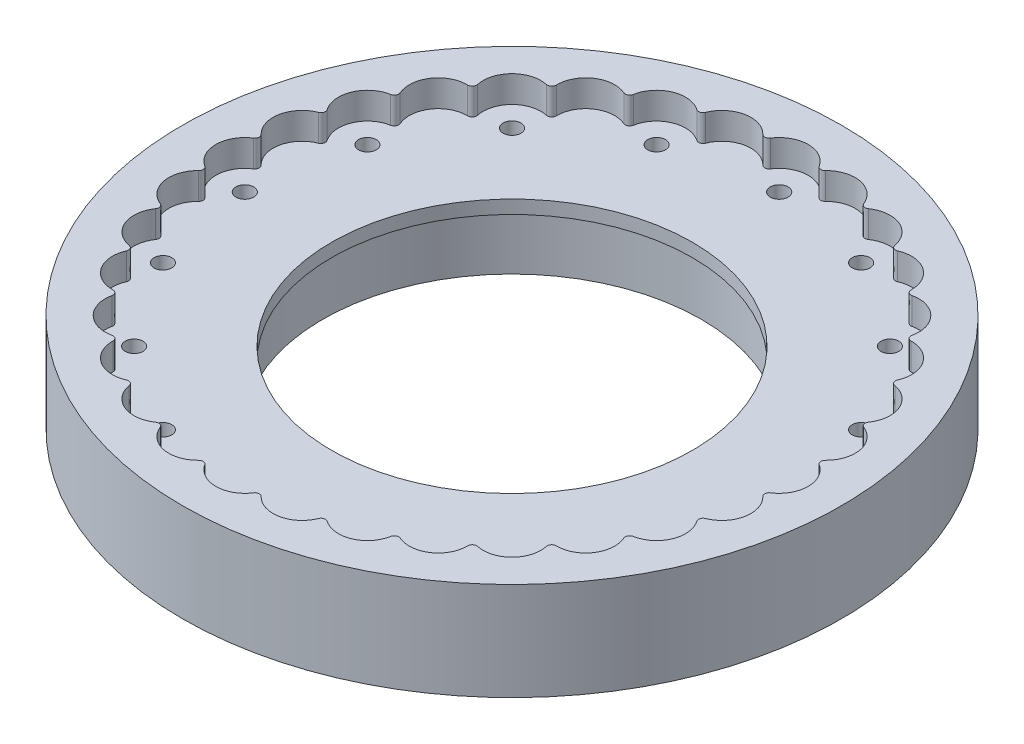
from build123d import *

# Parameters (mm, degrees)
SKETCH_1_R          = 74
EXTRUDE_1_DEPTH     = 6
EXTRUDE_START       = 16
SKETCH_2_R          = 74
EXTRUDE_2_DEPTH     = 16
SKETCH_3_R          = 2
CUT_EXTRUDE_1_DEPTH = 16
CUT_EXTRUDE_START   = -4.5
SKETCH_4_R          = 3.75
SKETCH_4_R_2        = 2
CUT_EXTRUDE_2_DEPTH = 4.5
FILLET_1_R          = 1
FILLET_2_R          = 1
SKETCH_5_R          = 40.5
CUT_EXTRUDE_5_DEPTH = 110.036691231
SKETCH_6_R          = 42.5
CUT_EXTRUDE_6_DEPTH = 13


with BuildPart() as part:
    # 草图1 → 凸台-拉伸1 (new body)
    with BuildSketch(Plane(origin=(0, 0, 0), x_dir=(1, 0, 0), z_dir=(0, 1, 0))):
        with Locations(Location((-3, 0, 0), (0, 0, 270))):
            Circle(SKETCH_1_R)
        with BuildLine():
            ThreePointArc((-68.222221147, 12.973506414), (-67.787057046, 9.065890923), (-65.178531856, 6.124050861))
            ThreePointArc((-65.178531856, 6.124050861), (-68.310859491, 3.74763545), (-69.5, 0))
            ThreePointArc((-69.5, 0), (-68.310859491, -3.74763545), (-65.178531856, -6.124050861))
            ThreePointArc((-65.178531856, -6.124050861), (-67.787057046, -9.065890923), (-68.222221147, -12.973506414))
            ThreePointArc((-68.222221147, -12.973506414), (-66.324802233, -16.417142295), (-62.789045747, -18.136808743))
            ThreePointArc((-62.789045747, -18.136808743), (-64.773524332, -21.531020193), (-64.437988912, -25.448448252))
            ThreePointArc((-64.437988912, -25.448448252), (-61.905208337, -28.455747568), (-58.10190014, -29.452579237))
            ThreePointArc((-58.10190014, -29.452579237), (-59.38606972, -33.168724431), (-58.292729218, -36.945420496))
            ThreePointArc((-58.292729218, -36.945420496), (-55.22192032, -39.400814421), (-51.297219412, -39.636503628))
            ThreePointArc((-51.297219412, -39.636503628), (-51.831730071, -43.531773191), (-50.022600949, -47.022600949))
            ThreePointArc((-50.022600949, -47.022600949), (-46.531773191, -48.831730071), (-42.636503628, -48.297219412))
            ThreePointArc((-42.636503628, -48.297219412), (-42.400814421, -52.22192032), (-39.945420496, -55.292729218))
            ThreePointArc((-39.945420496, -55.292729218), (-36.168724431, -56.38606972), (-32.452579237, -55.10190014))
            ThreePointArc((-32.452579237, -55.10190014), (-31.455747568, -58.905208337), (-28.448448252, -61.437988912))
            ThreePointArc((-28.448448252, -61.437988912), (-24.531020193, -61.773524332), (-21.136808743, -59.789045747))
            ThreePointArc((-21.136808743, -59.789045747), (-19.417142295, -63.324802232), (-15.973506414, -65.222221147))
            ThreePointArc((-15.973506414, -65.222221147), (-12.065890923, -64.787057046), (-9.124050861, -62.178531856))
            ThreePointArc((-9.124050861, -62.178531856), (-6.74763545, -65.310859491), (-3, -66.5))
            ThreePointArc((-3, -66.5), (0.74763545, -65.310859491), (3.124050861, -62.178531856))
            ThreePointArc((3.124050861, -62.178531856), (6.065890923, -64.787057046), (9.973506414, -65.222221147))
            ThreePointArc((9.973506414, -65.222221147), (13.417142295, -63.324802232), (15.136808743, -59.789045747))
            ThreePointArc((15.136808743, -59.789045747), (18.531020193, -61.773524332), (22.448448252, -61.437988912))
            ThreePointArc((22.448448252, -61.437988912), (25.455747568, -58.905208337), (26.452579237, -55.10190014))
            ThreePointArc((26.452579237, -55.10190014), (30.168724431, -56.38606972), (33.945420496, -55.292729218))
            ThreePointArc((33.945420496, -55.292729218), (36.400814421, -52.22192032), (36.636503628, -48.297219412))
            ThreePointArc((36.636503628, -48.297219412), (40.531773191, -48.831730071), (44.022600949, -47.022600949))
            ThreePointArc((44.022600949, -47.022600949), (45.831730071, -43.531773191), (45.297219412, -39.636503628))
            ThreePointArc((45.297219412, -39.636503628), (49.22192032, -39.400814421), (52.292729218, -36.945420496))
            ThreePointArc((52.292729218, -36.945420496), (53.38606972, -33.168724431), (52.10190014, -29.452579237))
            ThreePointArc((52.10190014, -29.452579237), (55.905208337, -28.455747568), (58.437988912, -25.448448252))
            ThreePointArc((58.437988912, -25.448448252), (58.773524332, -21.531020193), (56.789045747, -18.136808743))
            ThreePointArc((56.789045747, -18.136808743), (60.324802232, -16.417142295), (62.222221147, -12.973506414))
            ThreePointArc((62.222221147, -12.973506414), (61.787057046, -9.065890923), (59.178531856, -6.124050861))
            ThreePointArc((59.178531856, -6.124050861), (62.310859491, -3.74763545), (63.5, 0))
            ThreePointArc((63.5, 0), (62.310859491, 3.74763545), (59.178531856, 6.124050861))
            ThreePointArc((59.178531856, 6.124050861), (61.787057046, 9.065890923), (62.222221147, 12.973506414))
            ThreePointArc((62.222221147, 12.973506414), (60.324802232, 16.417142295), (56.789045747, 18.136808743))
            ThreePointArc((56.789045747, 18.136808743), (58.773524332, 21.531020193), (58.437988912, 25.448448252))
            ThreePointArc((58.437988912, 25.448448252), (55.905208337, 28.455747568), (52.10190014, 29.452579237))
            ThreePointArc((52.10190014, 29.452579237), (53.38606972, 33.168724431), (52.292729218, 36.945420496))
            ThreePointArc((52.292729218, 36.945420496), (49.22192032, 39.400814421), (45.297219412, 39.636503628))
            ThreePointArc((45.297219412, 39.636503628), (45.831730071, 43.531773191), (44.022600949, 47.022600949))
            ThreePointArc((44.022600949, 47.022600949), (40.531773191, 48.831730071), (36.636503628, 48.297219412))
            ThreePointArc((36.636503628, 48.297219412), (36.400814421, 52.22192032), (33.945420496, 55.292729218))
            ThreePointArc((33.945420496, 55.292729218), (30.168724431, 56.38606972), (26.452579237, 55.10190014))
            ThreePointArc((26.452579237, 55.10190014), (25.455747568, 58.905208337), (22.448448252, 61.437988912))
            ThreePointArc((22.448448252, 61.437988912), (18.531020193, 61.773524332), (15.136808743, 59.789045747))
            ThreePointArc((15.136808743, 59.789045747), (13.417142295, 63.324802232), (9.973506414, 65.222221147))
            ThreePointArc((9.973506414, 65.222221147), (6.065890923, 64.787057046), (3.124050861, 62.178531856))
            ThreePointArc((3.124050861, 62.178531856), (0.74763545, 65.310859491), (-3, 66.5))
            ThreePointArc((-3, 66.5), (-6.74763545, 65.310859491), (-9.124050861, 62.178531856))
            ThreePointArc((-9.124050861, 62.178531856), (-12.065890923, 64.787057046), (-15.973506414, 65.222221147))
            ThreePointArc((-15.973506414, 65.222221147), (-19.417142295, 63.324802232), (-21.136808743, 59.789045747))
            ThreePointArc((-21.136808743, 59.789045747), (-24.531020193, 61.773524332), (-28.448448252, 61.437988912))
            ThreePointArc((-28.448448252, 61.437988912), (-31.455747568, 58.905208337), (-32.452579237, 55.10190014))
            ThreePointArc((-32.452579237, 55.10190014), (-36.168724431, 56.38606972), (-39.945420496, 55.292729218))
            ThreePointArc((-39.945420496, 55.292729218), (-42.400814421, 52.22192032), (-42.636503628, 48.297219412))
            ThreePointArc((-42.636503628, 48.297219412), (-46.531773191, 48.831730071), (-50.022600949, 47.022600949))
            ThreePointArc((-50.022600949, 47.022600949), (-51.831730071, 43.531773191), (-51.297219412, 39.636503628))
            ThreePointArc((-51.297219412, 39.636503628), (-55.22192032, 39.400814421), (-58.292729218, 36.945420496))
            ThreePointArc((-58.292729218, 36.945420496), (-59.38606972, 33.168724431), (-58.10190014, 29.452579237))
            ThreePointArc((-58.10190014, 29.452579237), (-61.905208337, 28.455747568), (-64.437988912, 25.448448252))
            ThreePointArc((-64.437988912, 25.448448252), (-64.773524332, 21.531020193), (-62.789045747, 18.136808743))
            ThreePointArc((-62.789045747, 18.136808743), (-66.324802233, 16.417142295), (-68.222221147, 12.973506414))
        make_face(mode=Mode.SUBTRACT)
    extrude(amount=EXTRUDE_1_DEPTH)

    # 草图2 → 凸台-拉伸2 (add)
    with BuildSketch(Plane.XZ.offset(EXTRUDE_START)):
        with Locations(Location((-3, 0, 0), (0, 0, 270))):
            Circle(SKETCH_2_R)
    extrude(amount=-EXTRUDE_2_DEPTH)

    # 草图3 → 切除-拉伸1 (cut)
    with BuildSketch(Plane(origin=(0, 0, 0), x_dir=(1, 0, 0), z_dir=(0, 1, 0))):
        with Locations(Location((-63, 0, 0), (0, 0, 270))):
            Circle(SKETCH_3_R)
        with Locations(Location((-58.432771951, 22.961005942, 0), (0, 0, 270))):
            Circle(SKETCH_3_R)
        with Locations(Location((-45.426406871, 42.426406871, 0), (0, 0, 270))):
            Circle(SKETCH_3_R)
        with Locations(Location((-25.961005942, 55.432771951, 0), (0, 0, 270))):
            Circle(SKETCH_3_R)
        with Locations(Location((-3, 60, 0), (0, 0, 270))):
            Circle(SKETCH_3_R)
        with Locations(Location((19.961005942, 55.432771951, 0), (0, 0, 270))):
            Circle(SKETCH_3_R)
        with Locations(Location((39.426406871, 42.426406871, 0), (0, 0, 270))):
            Circle(SKETCH_3_R)
        with Locations(Location((52.432771951, 22.961005942, 0), (0, 0, 270))):
            Circle(SKETCH_3_R)
        with Locations(Location((57, 0, 0), (0, 0, 270))):
            Circle(SKETCH_3_R)
        with Locations(Location((52.432771951, -22.961005942, 0), (0, 0, 270))):
            Circle(SKETCH_3_R)
        with Locations(Location((39.426406871, -42.426406871, 0), (0, 0, 270))):
            Circle(SKETCH_3_R)
        with Locations(Location((19.961005942, -55.432771951, 0), (0, 0, 270))):
            Circle(SKETCH_3_R)
        with Locations(Location((-3, -60, 0), (0, 0, 270))):
            Circle(SKETCH_3_R)
        with Locations(Location((-25.961005942, -55.432771951, 0), (0, 0, 270))):
            Circle(SKETCH_3_R)
        with Locations(Location((-45.426406871, -42.426406871, 0), (0, 0, 270))):
            Circle(SKETCH_3_R)
        with Locations(Location((-58.432771951, -22.961005942, 0), (0, 0, 270))):
            Circle(SKETCH_3_R)
    extrude(amount=-CUT_EXTRUDE_1_DEPTH, mode=Mode.SUBTRACT)

    # 草图4 → 切除-拉伸2 (cut)
    # profile 1 of 16: a face of its own
    with BuildSketch(Plane.XZ.offset(16).offset(CUT_EXTRUDE_START)):
        with Locations(Location((-63, 0, 0), (0, 0, 270))):
            Circle(SKETCH_4_R)
        with Locations(Location((-63, 0, 0), (0, 0, 90))):
            Circle(SKETCH_4_R_2, mode=Mode.SUBTRACT)
    # profile 2 of 16: a face of its own
    with BuildSketch(Plane.XZ.offset(16).offset(CUT_EXTRUDE_START)):
        with Locations(Location((-58.432771951, 22.961005942, 0), (0, 0, 270))):
            Circle(SKETCH_4_R)
        with Locations(Location((-58.432771951, 22.961005942, 0), (0, 0, 90))):
            Circle(SKETCH_4_R_2, mode=Mode.SUBTRACT)
    # profile 3 of 16: a face of its own
    with BuildSketch(Plane.XZ.offset(16).offset(CUT_EXTRUDE_START)):
        with Locations(Location((-45.426406871, 42.426406871, 0), (0, 0, 270))):
            Circle(SKETCH_4_R)
        with Locations(Location((-45.426406871, 42.426406871, 0), (0, 0, 90))):
            Circle(SKETCH_4_R_2, mode=Mode.SUBTRACT)
    # profile 4 of 16: a face of its own
    with BuildSketch(Plane.XZ.offset(16).offset(CUT_EXTRUDE_START)):
        with Locations(Location((-25.961005942, 55.432771951, 0), (0, 0, 270))):
            Circle(SKETCH_4_R)
        with Locations(Location((-25.961005942, 55.432771951, 0), (0, 0, 90))):
            Circle(SKETCH_4_R_2, mode=Mode.SUBTRACT)
    # profile 5 of 16: a face of its own
    with BuildSketch(Plane.XZ.offset(16).offset(CUT_EXTRUDE_START)):
        with Locations(Location((-3, 60, 0), (0, 0, 270))):
            Circle(SKETCH_4_R)
        with Locations(Location((-3, 60, 0), (0, 0, 90))):
            Circle(SKETCH_4_R_2, mode=Mode.SUBTRACT)
    # profile 6 of 16: a face of its own
    with BuildSketch(Plane.XZ.offset(16).offset(CUT_EXTRUDE_START)):
        with Locations(Location((19.961005942, 55.432771951, 0), (0, 0, 270))):
            Circle(SKETCH_4_R)
        with Locations(Location((19.961005942, 55.432771951, 0), (0, 0, 90))):
            Circle(SKETCH_4_R_2, mode=Mode.SUBTRACT)
    # profile 7 of 16: a face of its own
    with BuildSketch(Plane.XZ.offset(16).offset(CUT_EXTRUDE_START)):
        with Locations(Location((39.426406871, 42.426406871, 0), (0, 0, 270))):
            Circle(SKETCH_4_R)
        with Locations(Location((39.426406871, 42.426406871, 0), (0, 0, 90))):
            Circle(SKETCH_4_R_2, mode=Mode.SUBTRACT)
    # profile 8 of 16: a face of its own
    with BuildSketch(Plane.XZ.offset(16).offset(CUT_EXTRUDE_START)):
        with Locations(Location((52.432771951, 22.961005942, 0), (0, 0, 270))):
            Circle(SKETCH_4_R)
        with Locations(Location((52.432771951, 22.961005942, 0), (0, 0, 90))):
            Circle(SKETCH_4_R_2, mode=Mode.SUBTRACT)
    # profile 9 of 16: a face of its own
    with BuildSketch(Plane.XZ.offset(16).offset(CUT_EXTRUDE_START)):
        with Locations(Location((57, 0, 0), (0, 0, 270))):
            Circle(SKETCH_4_R)
        with Locations(Location((57, 0, 0), (0, 0, 90))):
            Circle(SKETCH_4_R_2, mode=Mode.SUBTRACT)
    # profile 10 of 16: a face of its own
    with BuildSketch(Plane.XZ.offset(16).offset(CUT_EXTRUDE_START)):
        with Locations(Location((52.432771951, -22.961005942, 0), (0, 0, 270))):
            Circle(SKETCH_4_R)
        with Locations(Location((52.432771951, -22.961005942, 0), (0, 0, 90))):
            Circle(SKETCH_4_R_2, mode=Mode.SUBTRACT)
    # profile 11 of 16: a face of its own
    with BuildSketch(Plane.XZ.offset(16).offset(CUT_EXTRUDE_START)):
        with Locations(Location((39.426406871, -42.426406871, 0), (0, 0, 270))):
            Circle(SKETCH_4_R)
        with Locations(Location((39.426406871, -42.426406871, 0), (0, 0, 90))):
            Circle(SKETCH_4_R_2, mode=Mode.SUBTRACT)
    # profile 12 of 16: a face of its own
    with BuildSketch(Plane.XZ.offset(16).offset(CUT_EXTRUDE_START)):
        with Locations(Location((19.961005942, -55.432771951, 0), (0, 0, 270))):
            Circle(SKETCH_4_R)
        with Locations(Location((19.961005942, -55.432771951, 0), (0, 0, 90))):
            Circle(SKETCH_4_R_2, mode=Mode.SUBTRACT)
    # profile 13 of 16: a face of its own
    with BuildSketch(Plane.XZ.offset(16).offset(CUT_EXTRUDE_START)):
        with Locations(Location((-3, -60, 0), (0, 0, 270))):
            Circle(SKETCH_4_R)
        with Locations(Location((-3, -60, 0), (0, 0, 90))):
            Circle(SKETCH_4_R_2, mode=Mode.SUBTRACT)
    # profile 14 of 16: a face of its own
    with BuildSketch(Plane.XZ.offset(16).offset(CUT_EXTRUDE_START)):
        with Locations(Location((-25.961005942, -55.432771951, 0), (0, 0, 270))):
            Circle(SKETCH_4_R)
        with Locations(Location((-25.961005942, -55.432771951, 0), (0, 0, 90))):
            Circle(SKETCH_4_R_2, mode=Mode.SUBTRACT)
    # profile 15 of 16: a face of its own
    with BuildSketch(Plane.XZ.offset(16).offset(CUT_EXTRUDE_START)):
        with Locations(Location((-45.426406871, -42.426406871, 0), (0, 0, 270))):
            Circle(SKETCH_4_R)
        with Locations(Location((-45.426406871, -42.426406871, 0), (0, 0, 90))):
            Circle(SKETCH_4_R_2, mode=Mode.SUBTRACT)
    # profile 16 of 16: a face of its own
    with BuildSketch(Plane.XZ.offset(16).offset(CUT_EXTRUDE_START)):
        with Locations(Location((-58.432771951, -22.961005942, 0), (0, 0, 270))):
            Circle(SKETCH_4_R)
        with Locations(Location((-58.432771951, -22.961005942, 0), (0, 0, 90))):
            Circle(SKETCH_4_R_2, mode=Mode.SUBTRACT)
    extrude(amount=CUT_EXTRUDE_2_DEPTH, mode=Mode.SUBTRACT)

    # 圆角1
    fillet_1_edges = [part.edges().sort_by_distance(p)[0] for p in [
        (36.636503628, 3, 48.297219412),
    ]]
    fillet(fillet_1_edges, radius=FILLET_1_R)

    # 圆角2
    fillet_2_edges = [part.edges().sort_by_distance(p)[0] for p in [
        (-65.178531856, 3, 6.124050861),
        (-62.789045747, 3, 18.136808743),
        (-58.10190014, 3, 29.452579237),
        (-51.297219412, 3, 39.636503628),
        (-42.636503628, 3, 48.297219412),
        (-32.452579237, 3, 55.10190014),
        (-21.136808743, 3, 59.789045747),
        (-9.124050861, 3, 62.178531856),
        (3.124050861, 3, 62.178531856),
        (15.136808743, 3, 59.789045747),
        (26.452579237, 3, 55.10190014),
        (45.297219412, 3, 39.636503628),
        (52.10190014, 3, 29.452579237),
        (56.789045747, 3, 18.136808743),
        (59.178531856, 3, 6.124050861),
        (59.178531856, 3, -6.124050861),
        (56.789045747, 3, -18.136808743),
        (52.10190014, 3, -29.452579237),
        (45.297219412, 3, -39.636503628),
        (36.636503628, 3, -48.297219412),
        (26.452579237, 3, -55.10190014),
        (15.136808743, 3, -59.789045747),
        (3.124050861, 3, -62.178531856),
        (-9.124050861, 3, -62.178531856),
        (-21.136808743, 3, -59.789045747),
        (-32.452579237, 3, -55.10190014),
        (-42.636503628, 3, -48.297219412),
        (-51.297219412, 3, -39.636503628),
        (-58.10190014, 3, -29.452579237),
        (-62.789045747, 3, -18.136808743),
        (-65.178531856, 3, -6.124050861),
    ]]
    fillet(fillet_2_edges, radius=FILLET_2_R)

    # 草图5 → 切除-拉伸5 (cut, through all)
    with BuildSketch(Plane.XZ.offset(16)):
        with Locations(Location((-3, 0, 0), (0, 0, 270))):
            Circle(SKETCH_5_R)
    extrude(amount=-CUT_EXTRUDE_5_DEPTH, mode=Mode.SUBTRACT)

    # 草图6 → 切除-拉伸6 (cut)
    with BuildSketch(Plane.XZ.offset(16)):
        with Locations(Location((-3, 0, 0), (0, 0, 270))):
            Circle(SKETCH_6_R)
    extrude(amount=-CUT_EXTRUDE_6_DEPTH, mode=Mode.SUBTRACT)


solid = part.part
